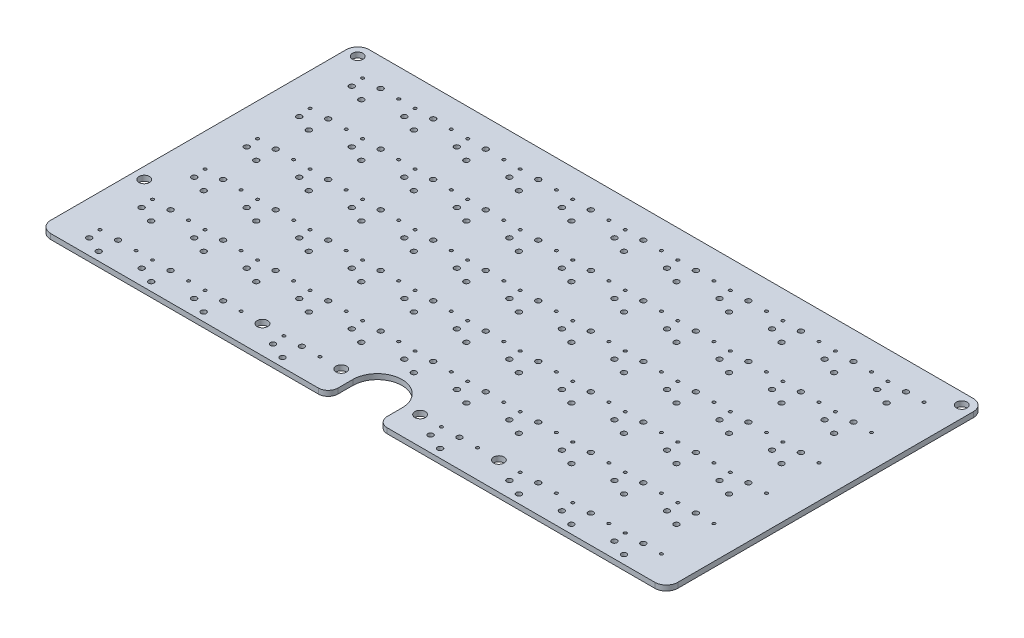
from build123d import *

# Parameters (mm, degrees)
SKETCH_2_R          = 0.80000094
SKETCH_2_R_2        = 0.4499991
SKETCH_2_R_3        = 0.79999332
SKETCH_2_R_4        = 0.80000348
EXTRUDE_2_DEPTH     = 1.6
SKETCH_3_R          = 1.6
CUT_EXTRUDE_1_DEPTH = 334.818906731


with BuildPart() as part:
    # 草图2 → 凸台-拉伸2 (new body)
    with BuildSketch(Plane(origin=(0, 0, 0), x_dir=(1, 0, 0), z_dir=(0, 1, 0))):
        with BuildLine():
            Line((187.49999838, 99.00000012), (187.49999838, 94.49999896))
            ThreePointArc((187.49999838, 94.49999896), (188.378677459, 92.378674931), (190.5, 91.49999226))
            Line((190.5, 91.49999226), (271.99999194, 91.49999226))
            ThreePointArc((271.99999194, 91.49999226), (274.474871501, 92.525120939), (275.50000018, 95.0000005))
            Line((275.50000018, 95.0000005), (275.50000526, 184.9999983))
            ThreePointArc((275.50000526, 184.9999983), (274.474876273, 187.474873525), (271.99999956, 188.49999892))
            Line((271.99999956, 188.49999892), (268.49999894, 188.49999892))
            Line((268.49999894, 188.49999892), (87.99999926, 188.49999892))
            ThreePointArc((87.99999926, 188.49999892), (85.525117467, 187.474875629), (84.4999834, 184.9999983))
            Line((84.4999834, 184.9999983), (84.49999864, 95.0000005))
            ThreePointArc((84.49999864, 95.0000005), (85.525125087, 92.525126327), (87.99999926, 91.49999988))
            Line((87.99999926, 91.49999988), (169.49998866, 91.49999988))
            ThreePointArc((169.49998866, 91.49999988), (171.621315973, 92.378676111), (172.50000298, 94.49999896))
            Line((172.50000298, 94.49999896), (172.50000298, 99.00000012))
            ThreePointArc((172.50000298, 99.00000012), (174.696701447, 104.303299353), (180.00000068, 106.49999782))
            ThreePointArc((180.00000068, 106.49999782), (185.303299913, 104.303299353), (187.49999838, 99.00000012))
        make_face()
        with Locations((260.0000007, 94.09999976)):
            Circle(SKETCH_2_R, mode=Mode.SUBTRACT)
        with Locations((255.00000054, 96.20000064)):
            Circle(SKETCH_2_R, mode=Mode.SUBTRACT)
        with Locations((95.0000005, 96.20000064)):
            Circle(SKETCH_2_R, mode=Mode.SUBTRACT)
        with Locations((100.00000066, 94.09999976)):
            Circle(SKETCH_2_R, mode=Mode.SUBTRACT)
        with Locations((100.00000066, 100.00000066)):
            Circle(SKETCH_2_R, mode=Mode.SUBTRACT)
        with Locations((105.49999982, 100.00000066)):
            Circle(SKETCH_2_R_2, mode=Mode.SUBTRACT)
        with Locations((94.5000015, 100.00000066)):
            Circle(SKETCH_2_R_2, mode=Mode.SUBTRACT)
        with Locations((254.50000154, 115.99999914)):
            Circle(SKETCH_2_R_2, mode=Mode.SUBTRACT)
        with Locations((158.5000005, 132.00000016)):
            Circle(SKETCH_2_R_2, mode=Mode.SUBTRACT)
        with Locations((174.50000152, 132.00000016)):
            Circle(SKETCH_2_R_2, mode=Mode.SUBTRACT)
        with Locations((185.49999984, 132.00000016)):
            Circle(SKETCH_2_R_2, mode=Mode.SUBTRACT)
        with Locations((180.00000068, 132.00000016)):
            Circle(SKETCH_2_R, mode=Mode.SUBTRACT)
        with Locations((180.00000068, 126.09999926)):
            Circle(SKETCH_2_R, mode=Mode.SUBTRACT)
        with Locations((175.00000052, 128.20000014)):
            Circle(SKETCH_2_R, mode=Mode.SUBTRACT)
        with Locations((190.999999, 128.20000014)):
            Circle(SKETCH_2_R, mode=Mode.SUBTRACT)
        with Locations((195.99999916, 126.09999926)):
            Circle(SKETCH_2_R, mode=Mode.SUBTRACT)
        with Locations((127, 176.20000066)):
            Circle(SKETCH_2_R, mode=Mode.SUBTRACT)
        with Locations((132.00000016, 174.09999978)):
            Circle(SKETCH_2_R, mode=Mode.SUBTRACT)
        with Locations((132.00000016, 180.00000068)):
            Circle(SKETCH_2_R, mode=Mode.SUBTRACT)
        with Locations((137.49999932, 180.00000068)):
            Circle(SKETCH_2_R_2, mode=Mode.SUBTRACT)
        with Locations((126.500001, 180.00000068)):
            Circle(SKETCH_2_R_2, mode=Mode.SUBTRACT)
        with Locations((142.50000202, 180.00000068)):
            Circle(SKETCH_2_R_2, mode=Mode.SUBTRACT)
        with Locations((153.50000034, 180.00000068)):
            Circle(SKETCH_2_R_2, mode=Mode.SUBTRACT)
        with Locations((148.00000118, 180.00000068)):
            Circle(SKETCH_2_R, mode=Mode.SUBTRACT)
        with Locations((254.50000154, 100.00000066)):
            Circle(SKETCH_2_R_2, mode=Mode.SUBTRACT)
        with Locations((265.49999986, 100.00000066)):
            Circle(SKETCH_2_R_2, mode=Mode.SUBTRACT)
        with Locations((260.0000007, 100.00000066)):
            Circle(SKETCH_2_R, mode=Mode.SUBTRACT)
        with Locations((153.50000034, 132.00000016)):
            Circle(SKETCH_2_R_2, mode=Mode.SUBTRACT)
        with Locations((148.00000118, 132.00000016)):
            Circle(SKETCH_2_R, mode=Mode.SUBTRACT)
        with Locations((148.00000118, 126.09999926)):
            Circle(SKETCH_2_R, mode=Mode.SUBTRACT)
        with Locations((143.00000102, 128.20000014)):
            Circle(SKETCH_2_R, mode=Mode.SUBTRACT)
        with Locations((158.9999995, 128.20000014)):
            Circle(SKETCH_2_R, mode=Mode.SUBTRACT)
        with Locations((163.99999966, 126.09999926)):
            Circle(SKETCH_2_R, mode=Mode.SUBTRACT)
        with Locations((163.99999966, 132.00000016)):
            Circle(SKETCH_2_R, mode=Mode.SUBTRACT)
        with Locations((169.49999882, 132.00000016)):
            Circle(SKETCH_2_R_2, mode=Mode.SUBTRACT)
        with Locations((100.00000066, 180.00000068)):
            Circle(SKETCH_2_R, mode=Mode.SUBTRACT)
        with Locations((105.49999982, 180.00000068)):
            Circle(SKETCH_2_R_2, mode=Mode.SUBTRACT)
        with Locations((94.5000015, 180.00000068)):
            Circle(SKETCH_2_R_2, mode=Mode.SUBTRACT)
        with Locations((110.49999998, 180.00000068)):
            Circle(SKETCH_2_R_2, mode=Mode.SUBTRACT)
        with Locations((121.4999983, 180.00000068)):
            Circle(SKETCH_2_R_2, mode=Mode.SUBTRACT)
        with Locations((115.99999914, 180.00000068)):
            Circle(SKETCH_2_R, mode=Mode.SUBTRACT)
        with Locations((115.99999914, 174.09999978)):
            Circle(SKETCH_2_R, mode=Mode.SUBTRACT)
        with Locations((110.99999898, 176.20000066)):
            Circle(SKETCH_2_R, mode=Mode.SUBTRACT)
        with Locations((115.99999914, 126.09999926)):
            Circle(SKETCH_2_R, mode=Mode.SUBTRACT)
        with Locations((110.99999898, 128.20000014)):
            Circle(SKETCH_2_R, mode=Mode.SUBTRACT)
        with Locations((127, 128.20000014)):
            Circle(SKETCH_2_R, mode=Mode.SUBTRACT)
        with Locations((132.00000016, 126.09999926)):
            Circle(SKETCH_2_R, mode=Mode.SUBTRACT)
        with Locations((132.00000016, 132.00000016)):
            Circle(SKETCH_2_R, mode=Mode.SUBTRACT)
        with Locations((137.49999932, 132.00000016)):
            Circle(SKETCH_2_R_2, mode=Mode.SUBTRACT)
        with Locations((126.500001, 132.00000016)):
            Circle(SKETCH_2_R_2, mode=Mode.SUBTRACT)
        with Locations((142.50000202, 132.00000016)):
            Circle(SKETCH_2_R_2, mode=Mode.SUBTRACT)
        with Locations((222.50000204, 163.99999966)):
            Circle(SKETCH_2_R_2, mode=Mode.SUBTRACT)
        with Locations((238.50000052, 163.99999966)):
            Circle(SKETCH_2_R_2, mode=Mode.SUBTRACT)
        with Locations((249.49999884, 163.99999966)):
            Circle(SKETCH_2_R_2, mode=Mode.SUBTRACT)
        with Locations((243.99999968, 163.99999966)):
            Circle(SKETCH_2_R, mode=Mode.SUBTRACT)
        with Locations((243.99999968, 158.09999876)):
            Circle(SKETCH_2_R, mode=Mode.SUBTRACT)
        with Locations((238.99999952, 160.19999964)):
            Circle(SKETCH_2_R, mode=Mode.SUBTRACT)
        with Locations((95.0000005, 176.20000066)):
            Circle(SKETCH_2_R, mode=Mode.SUBTRACT)
        with Locations((100.00000066, 174.09999978)):
            Circle(SKETCH_2_R, mode=Mode.SUBTRACT)
        with Locations((95.0000005, 128.20000014)):
            Circle(SKETCH_2_R, mode=Mode.SUBTRACT)
        with Locations((100.00000066, 126.09999926)):
            Circle(SKETCH_2_R, mode=Mode.SUBTRACT)
        with Locations((100.00000066, 132.00000016)):
            Circle(SKETCH_2_R, mode=Mode.SUBTRACT)
        with Locations((105.49999982, 132.00000016)):
            Circle(SKETCH_2_R_2, mode=Mode.SUBTRACT)
        with Locations((94.5000015, 132.00000016)):
            Circle(SKETCH_2_R_2, mode=Mode.SUBTRACT)
        with Locations((110.49999998, 132.00000016)):
            Circle(SKETCH_2_R_2, mode=Mode.SUBTRACT)
        with Locations((121.4999983, 132.00000016)):
            Circle(SKETCH_2_R_2, mode=Mode.SUBTRACT)
        with Locations((115.99999914, 132.00000016)):
            Circle(SKETCH_2_R, mode=Mode.SUBTRACT)
        with Locations((217.49999934, 163.99999966)):
            Circle(SKETCH_2_R_2, mode=Mode.SUBTRACT)
        with Locations((212.00000018, 163.99999966)):
            Circle(SKETCH_2_R, mode=Mode.SUBTRACT)
        with Locations((212.00000018, 158.09999876)):
            Circle(SKETCH_2_R, mode=Mode.SUBTRACT)
        with Locations((207.00000002, 160.19999964)):
            Circle(SKETCH_2_R, mode=Mode.SUBTRACT)
        with Locations((223.00000104, 160.19999964)):
            Circle(SKETCH_2_R, mode=Mode.SUBTRACT)
        with Locations((228.0000012, 158.09999876)):
            Circle(SKETCH_2_R, mode=Mode.SUBTRACT)
        with Locations((228.0000012, 163.99999966)):
            Circle(SKETCH_2_R, mode=Mode.SUBTRACT)
        with Locations((233.50000036, 163.99999966)):
            Circle(SKETCH_2_R_2, mode=Mode.SUBTRACT)
        with Locations((228.0000012, 115.99999914)):
            Circle(SKETCH_2_R, mode=Mode.SUBTRACT)
        with Locations((233.50000036, 115.99999914)):
            Circle(SKETCH_2_R_2, mode=Mode.SUBTRACT)
        with Locations((222.50000204, 115.99999914)):
            Circle(SKETCH_2_R_2, mode=Mode.SUBTRACT)
        with Locations((238.50000052, 115.99999914)):
            Circle(SKETCH_2_R_2, mode=Mode.SUBTRACT)
        with Locations((249.49999884, 115.99999914)):
            Circle(SKETCH_2_R_2, mode=Mode.SUBTRACT)
        with Locations((243.99999968, 115.99999914)):
            Circle(SKETCH_2_R, mode=Mode.SUBTRACT)
        with Locations((243.99999968, 110.09999824)):
            Circle(SKETCH_2_R, mode=Mode.SUBTRACT)
        with Locations((238.99999952, 112.19999912)):
            Circle(SKETCH_2_R, mode=Mode.SUBTRACT)
        with Locations((180.00000068, 158.09999876)):
            Circle(SKETCH_2_R, mode=Mode.SUBTRACT)
        with Locations((175.00000052, 160.19999964)):
            Circle(SKETCH_2_R, mode=Mode.SUBTRACT)
        with Locations((190.999999, 160.19999964)):
            Circle(SKETCH_2_R, mode=Mode.SUBTRACT)
        with Locations((195.99999916, 158.09999876)):
            Circle(SKETCH_2_R, mode=Mode.SUBTRACT)
        with Locations((195.99999916, 163.99999966)):
            Circle(SKETCH_2_R, mode=Mode.SUBTRACT)
        with Locations((201.49999832, 163.99999966)):
            Circle(SKETCH_2_R_2, mode=Mode.SUBTRACT)
        with Locations((190.5, 163.99999966)):
            Circle(SKETCH_2_R_2, mode=Mode.SUBTRACT)
        with Locations((206.50000102, 163.99999966)):
            Circle(SKETCH_2_R_2, mode=Mode.SUBTRACT)
        with Locations((190.5, 115.99999914)):
            Circle(SKETCH_2_R_2, mode=Mode.SUBTRACT)
        with Locations((206.50000102, 115.99999914)):
            Circle(SKETCH_2_R_2, mode=Mode.SUBTRACT)
        with Locations((217.49999934, 115.99999914)):
            Circle(SKETCH_2_R_2, mode=Mode.SUBTRACT)
        with Locations((212.00000018, 115.99999914)):
            Circle(SKETCH_2_R, mode=Mode.SUBTRACT)
        with Locations((212.00000018, 110.09999824)):
            Circle(SKETCH_2_R, mode=Mode.SUBTRACT)
        with Locations((207.00000002, 112.19999912)):
            Circle(SKETCH_2_R, mode=Mode.SUBTRACT)
        with Locations((223.00000104, 112.19999912)):
            Circle(SKETCH_2_R, mode=Mode.SUBTRACT)
        with Locations((228.0000012, 110.09999824)):
            Circle(SKETCH_2_R, mode=Mode.SUBTRACT)
        with Locations((158.9999995, 160.19999964)):
            Circle(SKETCH_2_R, mode=Mode.SUBTRACT)
        with Locations((163.99999966, 158.09999876)):
            Circle(SKETCH_2_R, mode=Mode.SUBTRACT)
        with Locations((163.99999966, 163.99999966)):
            Circle(SKETCH_2_R, mode=Mode.SUBTRACT)
        with Locations((169.49999882, 163.99999966)):
            Circle(SKETCH_2_R_2, mode=Mode.SUBTRACT)
        with Locations((158.5000005, 163.99999966)):
            Circle(SKETCH_2_R_2, mode=Mode.SUBTRACT)
        with Locations((174.50000152, 163.99999966)):
            Circle(SKETCH_2_R_2, mode=Mode.SUBTRACT)
        with Locations((185.49999984, 163.99999966)):
            Circle(SKETCH_2_R_2, mode=Mode.SUBTRACT)
        with Locations((180.00000068, 163.99999966)):
            Circle(SKETCH_2_R, mode=Mode.SUBTRACT)
        with Locations((185.49999984, 115.99999914)):
            Circle(SKETCH_2_R_2, mode=Mode.SUBTRACT)
        with Locations((180.00000068, 115.99999914)):
            Circle(SKETCH_2_R, mode=Mode.SUBTRACT)
        with Locations((180.00000068, 110.09999824)):
            Circle(SKETCH_2_R, mode=Mode.SUBTRACT)
        with Locations((175.00000052, 112.19999912)):
            Circle(SKETCH_2_R, mode=Mode.SUBTRACT)
        with Locations((190.999999, 112.19999912)):
            Circle(SKETCH_2_R, mode=Mode.SUBTRACT)
        with Locations((195.99999916, 110.09999824)):
            Circle(SKETCH_2_R, mode=Mode.SUBTRACT)
        with Locations((195.99999916, 115.99999914)):
            Circle(SKETCH_2_R, mode=Mode.SUBTRACT)
        with Locations((201.49999832, 115.99999914)):
            Circle(SKETCH_2_R_2, mode=Mode.SUBTRACT)
        with Locations((132.00000016, 163.99999966)):
            Circle(SKETCH_2_R, mode=Mode.SUBTRACT)
        with Locations((137.49999932, 163.99999966)):
            Circle(SKETCH_2_R_2, mode=Mode.SUBTRACT)
        with Locations((126.500001, 163.99999966)):
            Circle(SKETCH_2_R_2, mode=Mode.SUBTRACT)
        with Locations((142.50000202, 163.99999966)):
            Circle(SKETCH_2_R_2, mode=Mode.SUBTRACT)
        with Locations((153.50000034, 163.99999966)):
            Circle(SKETCH_2_R_2, mode=Mode.SUBTRACT)
        with Locations((148.00000118, 163.99999966)):
            Circle(SKETCH_2_R, mode=Mode.SUBTRACT)
        with Locations((148.00000118, 158.09999876)):
            Circle(SKETCH_2_R, mode=Mode.SUBTRACT)
        with Locations((143.00000102, 160.19999964)):
            Circle(SKETCH_2_R, mode=Mode.SUBTRACT)
        with Locations((148.00000118, 110.09999824)):
            Circle(SKETCH_2_R, mode=Mode.SUBTRACT)
        with Locations((143.00000102, 112.19999912)):
            Circle(SKETCH_2_R, mode=Mode.SUBTRACT)
        with Locations((158.9999995, 112.19999912)):
            Circle(SKETCH_2_R, mode=Mode.SUBTRACT)
        with Locations((163.99999966, 110.09999824)):
            Circle(SKETCH_2_R, mode=Mode.SUBTRACT)
        with Locations((163.99999966, 115.99999914)):
            Circle(SKETCH_2_R, mode=Mode.SUBTRACT)
        with Locations((169.49999882, 115.99999914)):
            Circle(SKETCH_2_R_2, mode=Mode.SUBTRACT)
        with Locations((158.5000005, 115.99999914)):
            Circle(SKETCH_2_R_2, mode=Mode.SUBTRACT)
        with Locations((174.50000152, 115.99999914)):
            Circle(SKETCH_2_R_2, mode=Mode.SUBTRACT)
        with Locations((94.5000015, 163.99999966)):
            Circle(SKETCH_2_R_2, mode=Mode.SUBTRACT)
        with Locations((110.49999998, 163.99999966)):
            Circle(SKETCH_2_R_2, mode=Mode.SUBTRACT)
        with Locations((121.4999983, 163.99999966)):
            Circle(SKETCH_2_R_2, mode=Mode.SUBTRACT)
        with Locations((115.99999914, 163.99999966)):
            Circle(SKETCH_2_R, mode=Mode.SUBTRACT)
        with Locations((115.99999914, 158.09999876)):
            Circle(SKETCH_2_R, mode=Mode.SUBTRACT)
        with Locations((110.99999898, 160.19999964)):
            Circle(SKETCH_2_R, mode=Mode.SUBTRACT)
        with Locations((127, 160.19999964)):
            Circle(SKETCH_2_R, mode=Mode.SUBTRACT)
        with Locations((132.00000016, 158.09999876)):
            Circle(SKETCH_2_R, mode=Mode.SUBTRACT)
        with Locations((127, 112.19999912)):
            Circle(SKETCH_2_R, mode=Mode.SUBTRACT)
        with Locations((132.00000016, 110.09999824)):
            Circle(SKETCH_2_R, mode=Mode.SUBTRACT)
        with Locations((132.00000016, 115.99999914)):
            Circle(SKETCH_2_R, mode=Mode.SUBTRACT)
        with Locations((137.49999932, 115.99999914)):
            Circle(SKETCH_2_R_2, mode=Mode.SUBTRACT)
        with Locations((126.500001, 115.99999914)):
            Circle(SKETCH_2_R_2, mode=Mode.SUBTRACT)
        with Locations((142.50000202, 115.99999914)):
            Circle(SKETCH_2_R_2, mode=Mode.SUBTRACT)
        with Locations((153.50000034, 115.99999914)):
            Circle(SKETCH_2_R_2, mode=Mode.SUBTRACT)
        with Locations((148.00000118, 115.99999914)):
            Circle(SKETCH_2_R, mode=Mode.SUBTRACT)
        with Locations((249.49999884, 148.00000118)):
            Circle(SKETCH_2_R_2, mode=Mode.SUBTRACT)
        with Locations((243.99999968, 148.00000118)):
            Circle(SKETCH_2_R, mode=Mode.SUBTRACT)
        with Locations((243.99999968, 142.10000028)):
            Circle(SKETCH_2_R, mode=Mode.SUBTRACT)
        with Locations((238.99999952, 144.20000116)):
            Circle(SKETCH_2_R, mode=Mode.SUBTRACT)
        with Locations((95.0000005, 160.19999964)):
            Circle(SKETCH_2_R, mode=Mode.SUBTRACT)
        with Locations((100.00000066, 158.09999876)):
            Circle(SKETCH_2_R, mode=Mode.SUBTRACT)
        with Locations((100.00000066, 163.99999966)):
            Circle(SKETCH_2_R, mode=Mode.SUBTRACT)
        with Locations((105.49999982, 163.99999966)):
            Circle(SKETCH_2_R_2, mode=Mode.SUBTRACT)
        with Locations((100.00000066, 115.99999914)):
            Circle(SKETCH_2_R, mode=Mode.SUBTRACT)
        with Locations((105.49999982, 115.99999914)):
            Circle(SKETCH_2_R_2, mode=Mode.SUBTRACT)
        with Locations((94.5000015, 115.99999914)):
            Circle(SKETCH_2_R_2, mode=Mode.SUBTRACT)
        with Locations((110.49999998, 115.99999914)):
            Circle(SKETCH_2_R_2, mode=Mode.SUBTRACT)
        with Locations((121.4999983, 115.99999914)):
            Circle(SKETCH_2_R_2, mode=Mode.SUBTRACT)
        with Locations((115.99999914, 115.99999914)):
            Circle(SKETCH_2_R, mode=Mode.SUBTRACT)
        with Locations((115.99999914, 110.09999824)):
            Circle(SKETCH_2_R, mode=Mode.SUBTRACT)
        with Locations((110.99999898, 112.19999912)):
            Circle(SKETCH_2_R, mode=Mode.SUBTRACT)
        with Locations((212.00000018, 142.10000028)):
            Circle(SKETCH_2_R, mode=Mode.SUBTRACT)
        with Locations((207.00000002, 144.20000116)):
            Circle(SKETCH_2_R, mode=Mode.SUBTRACT)
        with Locations((223.00000104, 144.20000116)):
            Circle(SKETCH_2_R, mode=Mode.SUBTRACT)
        with Locations((228.0000012, 142.10000028)):
            Circle(SKETCH_2_R, mode=Mode.SUBTRACT)
        with Locations((228.0000012, 148.00000118)):
            Circle(SKETCH_2_R, mode=Mode.SUBTRACT)
        with Locations((233.50000036, 148.00000118)):
            Circle(SKETCH_2_R_2, mode=Mode.SUBTRACT)
        with Locations((222.50000204, 148.00000118)):
            Circle(SKETCH_2_R_2, mode=Mode.SUBTRACT)
        with Locations((238.50000052, 148.00000118)):
            Circle(SKETCH_2_R_2, mode=Mode.SUBTRACT)
        with Locations((222.50000204, 100.00000066)):
            Circle(SKETCH_2_R_2, mode=Mode.SUBTRACT)
        with Locations((238.50000052, 100.00000066)):
            Circle(SKETCH_2_R_2, mode=Mode.SUBTRACT)
        with Locations((249.49999884, 100.00000066)):
            Circle(SKETCH_2_R_2, mode=Mode.SUBTRACT)
        with Locations((243.99999968, 100.00000066)):
            Circle(SKETCH_2_R, mode=Mode.SUBTRACT)
        with Locations((243.99999968, 94.09999976)):
            Circle(SKETCH_2_R, mode=Mode.SUBTRACT)
        with Locations((238.99999952, 96.20000064)):
            Circle(SKETCH_2_R, mode=Mode.SUBTRACT)
        with Locations((95.0000005, 112.19999912)):
            Circle(SKETCH_2_R, mode=Mode.SUBTRACT)
        with Locations((100.00000066, 110.09999824)):
            Circle(SKETCH_2_R, mode=Mode.SUBTRACT)
        with Locations((190.999999, 144.20000116)):
            Circle(SKETCH_2_R, mode=Mode.SUBTRACT)
        with Locations((195.99999916, 142.10000028)):
            Circle(SKETCH_2_R, mode=Mode.SUBTRACT)
        with Locations((195.99999916, 148.00000118)):
            Circle(SKETCH_2_R, mode=Mode.SUBTRACT)
        with Locations((201.49999832, 148.00000118)):
            Circle(SKETCH_2_R_2, mode=Mode.SUBTRACT)
        with Locations((190.5, 148.00000118)):
            Circle(SKETCH_2_R_2, mode=Mode.SUBTRACT)
        with Locations((206.50000102, 148.00000118)):
            Circle(SKETCH_2_R_2, mode=Mode.SUBTRACT)
        with Locations((217.49999934, 148.00000118)):
            Circle(SKETCH_2_R_2, mode=Mode.SUBTRACT)
        with Locations((212.00000018, 148.00000118)):
            Circle(SKETCH_2_R, mode=Mode.SUBTRACT)
        with Locations((209.5000001, 100.00000066)):
            Circle(SKETCH_2_R_2, mode=Mode.SUBTRACT)
        with Locations((204.00000094, 100.00000066)):
            Circle(SKETCH_2_R, mode=Mode.SUBTRACT)
        with Locations((204.00000094, 94.09999976)):
            Circle(SKETCH_2_R, mode=Mode.SUBTRACT)
        with Locations((199.00000078, 96.20000064)):
            Circle(SKETCH_2_R, mode=Mode.SUBTRACT)
        with Locations((223.00000104, 96.20000064)):
            Circle(SKETCH_2_R, mode=Mode.SUBTRACT)
        with Locations((228.0000012, 94.09999976)):
            Circle(SKETCH_2_R, mode=Mode.SUBTRACT)
        with Locations((228.0000012, 100.00000066)):
            Circle(SKETCH_2_R, mode=Mode.SUBTRACT)
        with Locations((233.50000036, 100.00000066)):
            Circle(SKETCH_2_R_2, mode=Mode.SUBTRACT)
        with Locations((163.99999966, 148.00000118)):
            Circle(SKETCH_2_R, mode=Mode.SUBTRACT)
        with Locations((169.49999882, 148.00000118)):
            Circle(SKETCH_2_R_2, mode=Mode.SUBTRACT)
        with Locations((158.5000005, 148.00000118)):
            Circle(SKETCH_2_R_2, mode=Mode.SUBTRACT)
        with Locations((174.50000152, 148.00000118)):
            Circle(SKETCH_2_R_2, mode=Mode.SUBTRACT)
        with Locations((185.49999984, 148.00000118)):
            Circle(SKETCH_2_R_2, mode=Mode.SUBTRACT)
        with Locations((180.00000068, 148.00000118)):
            Circle(SKETCH_2_R, mode=Mode.SUBTRACT)
        with Locations((180.00000068, 142.10000028)):
            Circle(SKETCH_2_R, mode=Mode.SUBTRACT)
        with Locations((175.00000052, 144.20000116)):
            Circle(SKETCH_2_R, mode=Mode.SUBTRACT)
        with Locations((260.0000007, 158.09999876)):
            Circle(SKETCH_2_R, mode=Mode.SUBTRACT)
        with Locations((255.00000054, 160.19999964)):
            Circle(SKETCH_2_R, mode=Mode.SUBTRACT)
        with Locations((255.00000054, 176.20000066)):
            Circle(SKETCH_2_R, mode=Mode.SUBTRACT)
        with Locations((260.0000007, 174.09999978)):
            Circle(SKETCH_2_R, mode=Mode.SUBTRACT)
        with Locations((260.0000007, 180.00000068)):
            Circle(SKETCH_2_R, mode=Mode.SUBTRACT)
        with Locations((265.49999986, 180.00000068)):
            Circle(SKETCH_2_R_2, mode=Mode.SUBTRACT)
        with Locations((254.50000154, 180.00000068)):
            Circle(SKETCH_2_R_2, mode=Mode.SUBTRACT)
        with Locations((198.50000178, 100.00000066)):
            Circle(SKETCH_2_R_2, mode=Mode.SUBTRACT)
        with Locations((126.500001, 148.00000118)):
            Circle(SKETCH_2_R_2, mode=Mode.SUBTRACT)
        with Locations((142.50000202, 148.00000118)):
            Circle(SKETCH_2_R_2, mode=Mode.SUBTRACT)
        with Locations((153.50000034, 148.00000118)):
            Circle(SKETCH_2_R_2, mode=Mode.SUBTRACT)
        with Locations((148.00000118, 148.00000118)):
            Circle(SKETCH_2_R, mode=Mode.SUBTRACT)
        with Locations((148.00000118, 142.10000028)):
            Circle(SKETCH_2_R, mode=Mode.SUBTRACT)
        with Locations((143.00000102, 144.20000116)):
            Circle(SKETCH_2_R, mode=Mode.SUBTRACT)
        with Locations((158.9999995, 144.20000116)):
            Circle(SKETCH_2_R, mode=Mode.SUBTRACT)
        with Locations((163.99999966, 142.10000028)):
            Circle(SKETCH_2_R, mode=Mode.SUBTRACT)
        with Locations((87.99999164, 184.99999068)):
            Circle(SKETCH_2_R_3, mode=Mode.SUBTRACT)
        with Locations((272.0000021, 184.99999576)):
            Circle(SKETCH_2_R_4, mode=Mode.SUBTRACT)
        with Locations((167.99999928, 100.00000066)):
            Circle(SKETCH_2_R, mode=Mode.SUBTRACT)
        with Locations((191.99999954, 100.00000066)):
            Circle(SKETCH_2_R, mode=Mode.SUBTRACT)
        with Locations((143.99999902, 100.00000066)):
            Circle(SKETCH_2_R, mode=Mode.SUBTRACT)
        with Locations((215.9999998, 100.00000066)):
            Circle(SKETCH_2_R, mode=Mode.SUBTRACT)
        with Locations((87.99999926, 119.99999876)):
            Circle(SKETCH_2_R, mode=Mode.SUBTRACT)
        with Locations((151.00000026, 96.20000064)):
            Circle(SKETCH_2_R, mode=Mode.SUBTRACT)
        with Locations((156.00000042, 94.09999976)):
            Circle(SKETCH_2_R, mode=Mode.SUBTRACT)
        with Locations((156.00000042, 100.00000066)):
            Circle(SKETCH_2_R, mode=Mode.SUBTRACT)
        with Locations((161.49999958, 100.00000066)):
            Circle(SKETCH_2_R_2, mode=Mode.SUBTRACT)
        with Locations((150.50000126, 100.00000066)):
            Circle(SKETCH_2_R_2, mode=Mode.SUBTRACT)
        with Locations((254.50000154, 163.99999966)):
            Circle(SKETCH_2_R_2, mode=Mode.SUBTRACT)
        with Locations((265.49999986, 163.99999966)):
            Circle(SKETCH_2_R_2, mode=Mode.SUBTRACT)
        with Locations((260.0000007, 163.99999966)):
            Circle(SKETCH_2_R, mode=Mode.SUBTRACT)
        with Locations((121.4999983, 148.00000118)):
            Circle(SKETCH_2_R_2, mode=Mode.SUBTRACT)
        with Locations((115.99999914, 148.00000118)):
            Circle(SKETCH_2_R, mode=Mode.SUBTRACT)
        with Locations((115.99999914, 142.10000028)):
            Circle(SKETCH_2_R, mode=Mode.SUBTRACT)
        with Locations((110.99999898, 144.20000116)):
            Circle(SKETCH_2_R, mode=Mode.SUBTRACT)
        with Locations((127, 144.20000116)):
            Circle(SKETCH_2_R, mode=Mode.SUBTRACT)
        with Locations((132.00000016, 142.10000028)):
            Circle(SKETCH_2_R, mode=Mode.SUBTRACT)
        with Locations((132.00000016, 148.00000118)):
            Circle(SKETCH_2_R, mode=Mode.SUBTRACT)
        with Locations((137.49999932, 148.00000118)):
            Circle(SKETCH_2_R_2, mode=Mode.SUBTRACT)
        with Locations((228.0000012, 180.00000068)):
            Circle(SKETCH_2_R, mode=Mode.SUBTRACT)
        with Locations((233.50000036, 180.00000068)):
            Circle(SKETCH_2_R_2, mode=Mode.SUBTRACT)
        with Locations((222.50000204, 180.00000068)):
            Circle(SKETCH_2_R_2, mode=Mode.SUBTRACT)
        with Locations((238.50000052, 180.00000068)):
            Circle(SKETCH_2_R_2, mode=Mode.SUBTRACT)
        with Locations((249.49999884, 180.00000068)):
            Circle(SKETCH_2_R_2, mode=Mode.SUBTRACT)
        with Locations((243.99999968, 180.00000068)):
            Circle(SKETCH_2_R, mode=Mode.SUBTRACT)
        with Locations((243.99999968, 174.09999978)):
            Circle(SKETCH_2_R, mode=Mode.SUBTRACT)
        with Locations((238.99999952, 176.20000066)):
            Circle(SKETCH_2_R, mode=Mode.SUBTRACT)
        with Locations((132.00000016, 100.00000066)):
            Circle(SKETCH_2_R, mode=Mode.SUBTRACT)
        with Locations((137.49999932, 100.00000066)):
            Circle(SKETCH_2_R_2, mode=Mode.SUBTRACT)
        with Locations((126.500001, 100.00000066)):
            Circle(SKETCH_2_R_2, mode=Mode.SUBTRACT)
        with Locations((254.50000154, 148.00000118)):
            Circle(SKETCH_2_R_2, mode=Mode.SUBTRACT)
        with Locations((265.49999986, 148.00000118)):
            Circle(SKETCH_2_R_2, mode=Mode.SUBTRACT)
        with Locations((260.0000007, 148.00000118)):
            Circle(SKETCH_2_R, mode=Mode.SUBTRACT)
        with Locations((260.0000007, 142.10000028)):
            Circle(SKETCH_2_R, mode=Mode.SUBTRACT)
        with Locations((255.00000054, 144.20000116)):
            Circle(SKETCH_2_R, mode=Mode.SUBTRACT)
        with Locations((243.99999968, 126.09999926)):
            Circle(SKETCH_2_R, mode=Mode.SUBTRACT)
        with Locations((238.99999952, 128.20000014)):
            Circle(SKETCH_2_R, mode=Mode.SUBTRACT)
        with Locations((95.0000005, 144.20000116)):
            Circle(SKETCH_2_R, mode=Mode.SUBTRACT)
        with Locations((100.00000066, 142.10000028)):
            Circle(SKETCH_2_R, mode=Mode.SUBTRACT)
        with Locations((100.00000066, 148.00000118)):
            Circle(SKETCH_2_R, mode=Mode.SUBTRACT)
        with Locations((105.49999982, 148.00000118)):
            Circle(SKETCH_2_R_2, mode=Mode.SUBTRACT)
        with Locations((94.5000015, 148.00000118)):
            Circle(SKETCH_2_R_2, mode=Mode.SUBTRACT)
        with Locations((110.49999998, 148.00000118)):
            Circle(SKETCH_2_R_2, mode=Mode.SUBTRACT)
        with Locations((190.5, 180.00000068)):
            Circle(SKETCH_2_R_2, mode=Mode.SUBTRACT)
        with Locations((206.50000102, 180.00000068)):
            Circle(SKETCH_2_R_2, mode=Mode.SUBTRACT)
        with Locations((217.49999934, 180.00000068)):
            Circle(SKETCH_2_R_2, mode=Mode.SUBTRACT)
        with Locations((212.00000018, 180.00000068)):
            Circle(SKETCH_2_R, mode=Mode.SUBTRACT)
        with Locations((212.00000018, 174.09999978)):
            Circle(SKETCH_2_R, mode=Mode.SUBTRACT)
        with Locations((207.00000002, 176.20000066)):
            Circle(SKETCH_2_R, mode=Mode.SUBTRACT)
        with Locations((223.00000104, 176.20000066)):
            Circle(SKETCH_2_R, mode=Mode.SUBTRACT)
        with Locations((228.0000012, 174.09999978)):
            Circle(SKETCH_2_R, mode=Mode.SUBTRACT)
        with Locations((110.49999998, 100.00000066)):
            Circle(SKETCH_2_R_2, mode=Mode.SUBTRACT)
        with Locations((254.50000154, 132.00000016)):
            Circle(SKETCH_2_R_2, mode=Mode.SUBTRACT)
        with Locations((265.49999986, 132.00000016)):
            Circle(SKETCH_2_R_2, mode=Mode.SUBTRACT)
        with Locations((260.0000007, 132.00000016)):
            Circle(SKETCH_2_R, mode=Mode.SUBTRACT)
        with Locations((260.0000007, 126.09999926)):
            Circle(SKETCH_2_R, mode=Mode.SUBTRACT)
        with Locations((255.00000054, 128.20000014)):
            Circle(SKETCH_2_R, mode=Mode.SUBTRACT)
        with Locations((127, 96.20000064)):
            Circle(SKETCH_2_R, mode=Mode.SUBTRACT)
        with Locations((132.00000016, 94.09999976)):
            Circle(SKETCH_2_R, mode=Mode.SUBTRACT)
        with Locations((223.00000104, 128.20000014)):
            Circle(SKETCH_2_R, mode=Mode.SUBTRACT)
        with Locations((228.0000012, 126.09999926)):
            Circle(SKETCH_2_R, mode=Mode.SUBTRACT)
        with Locations((228.0000012, 132.00000016)):
            Circle(SKETCH_2_R, mode=Mode.SUBTRACT)
        with Locations((233.50000036, 132.00000016)):
            Circle(SKETCH_2_R_2, mode=Mode.SUBTRACT)
        with Locations((222.50000204, 132.00000016)):
            Circle(SKETCH_2_R_2, mode=Mode.SUBTRACT)
        with Locations((238.50000052, 132.00000016)):
            Circle(SKETCH_2_R_2, mode=Mode.SUBTRACT)
        with Locations((249.49999884, 132.00000016)):
            Circle(SKETCH_2_R_2, mode=Mode.SUBTRACT)
        with Locations((243.99999968, 132.00000016)):
            Circle(SKETCH_2_R, mode=Mode.SUBTRACT)
        with Locations((185.49999984, 180.00000068)):
            Circle(SKETCH_2_R_2, mode=Mode.SUBTRACT)
        with Locations((180.00000068, 180.00000068)):
            Circle(SKETCH_2_R, mode=Mode.SUBTRACT)
        with Locations((180.00000068, 174.09999978)):
            Circle(SKETCH_2_R, mode=Mode.SUBTRACT)
        with Locations((175.00000052, 176.20000066)):
            Circle(SKETCH_2_R, mode=Mode.SUBTRACT)
        with Locations((190.999999, 176.20000066)):
            Circle(SKETCH_2_R, mode=Mode.SUBTRACT)
        with Locations((195.99999916, 174.09999978)):
            Circle(SKETCH_2_R, mode=Mode.SUBTRACT)
        with Locations((195.99999916, 180.00000068)):
            Circle(SKETCH_2_R, mode=Mode.SUBTRACT)
        with Locations((201.49999832, 180.00000068)):
            Circle(SKETCH_2_R_2, mode=Mode.SUBTRACT)
        with Locations((265.49999986, 115.99999914)):
            Circle(SKETCH_2_R_2, mode=Mode.SUBTRACT)
        with Locations((260.0000007, 115.99999914)):
            Circle(SKETCH_2_R, mode=Mode.SUBTRACT)
        with Locations((260.0000007, 110.09999824)):
            Circle(SKETCH_2_R, mode=Mode.SUBTRACT)
        with Locations((255.00000054, 112.19999912)):
            Circle(SKETCH_2_R, mode=Mode.SUBTRACT)
        with Locations((110.99999898, 96.20000064)):
            Circle(SKETCH_2_R, mode=Mode.SUBTRACT)
        with Locations((115.99999914, 94.09999976)):
            Circle(SKETCH_2_R, mode=Mode.SUBTRACT)
        with Locations((115.99999914, 100.00000066)):
            Circle(SKETCH_2_R, mode=Mode.SUBTRACT)
        with Locations((121.4999983, 100.00000066)):
            Circle(SKETCH_2_R_2, mode=Mode.SUBTRACT)
        with Locations((195.99999916, 132.00000016)):
            Circle(SKETCH_2_R, mode=Mode.SUBTRACT)
        with Locations((201.49999832, 132.00000016)):
            Circle(SKETCH_2_R_2, mode=Mode.SUBTRACT)
        with Locations((190.5, 132.00000016)):
            Circle(SKETCH_2_R_2, mode=Mode.SUBTRACT)
        with Locations((206.50000102, 132.00000016)):
            Circle(SKETCH_2_R_2, mode=Mode.SUBTRACT)
        with Locations((217.49999934, 132.00000016)):
            Circle(SKETCH_2_R_2, mode=Mode.SUBTRACT)
        with Locations((212.00000018, 132.00000016)):
            Circle(SKETCH_2_R, mode=Mode.SUBTRACT)
        with Locations((212.00000018, 126.09999926)):
            Circle(SKETCH_2_R, mode=Mode.SUBTRACT)
        with Locations((207.00000002, 128.20000014)):
            Circle(SKETCH_2_R, mode=Mode.SUBTRACT)
        with Locations((148.00000118, 174.09999978)):
            Circle(SKETCH_2_R, mode=Mode.SUBTRACT)
        with Locations((143.00000102, 176.20000066)):
            Circle(SKETCH_2_R, mode=Mode.SUBTRACT)
        with Locations((158.9999995, 176.20000066)):
            Circle(SKETCH_2_R, mode=Mode.SUBTRACT)
        with Locations((163.99999966, 174.09999978)):
            Circle(SKETCH_2_R, mode=Mode.SUBTRACT)
        with Locations((163.99999966, 180.00000068)):
            Circle(SKETCH_2_R, mode=Mode.SUBTRACT)
        with Locations((169.49999882, 180.00000068)):
            Circle(SKETCH_2_R_2, mode=Mode.SUBTRACT)
        with Locations((158.5000005, 180.00000068)):
            Circle(SKETCH_2_R_2, mode=Mode.SUBTRACT)
        with Locations((174.50000152, 180.00000068)):
            Circle(SKETCH_2_R_2, mode=Mode.SUBTRACT)
    extrude(amount=EXTRUDE_2_DEPTH)

    # 草图3 → 切除-拉伸1 (cut, through all)
    with BuildSketch(Plane(origin=(0, 1.6, 0), x_dir=(1, 0, 0), z_dir=(0, 1, 0))):
        with Locations((87.99999164, 184.99999068)):
            Circle(SKETCH_3_R)
        with Locations((87.99999926, 119.99999876)):
            Circle(SKETCH_3_R)
        with Locations((143.99999902, 100.00000066)):
            Circle(SKETCH_3_R)
        with Locations((167.99999928, 100.00000066)):
            Circle(SKETCH_3_R)
        with Locations((191.99999954, 100.00000066)):
            Circle(SKETCH_3_R)
        with Locations((215.9999998, 100.00000066)):
            Circle(SKETCH_3_R)
        with Locations((272.0000021, 184.99999576)):
            Circle(SKETCH_3_R)
    extrude(amount=-CUT_EXTRUDE_1_DEPTH, mode=Mode.SUBTRACT)


solid = part.part
